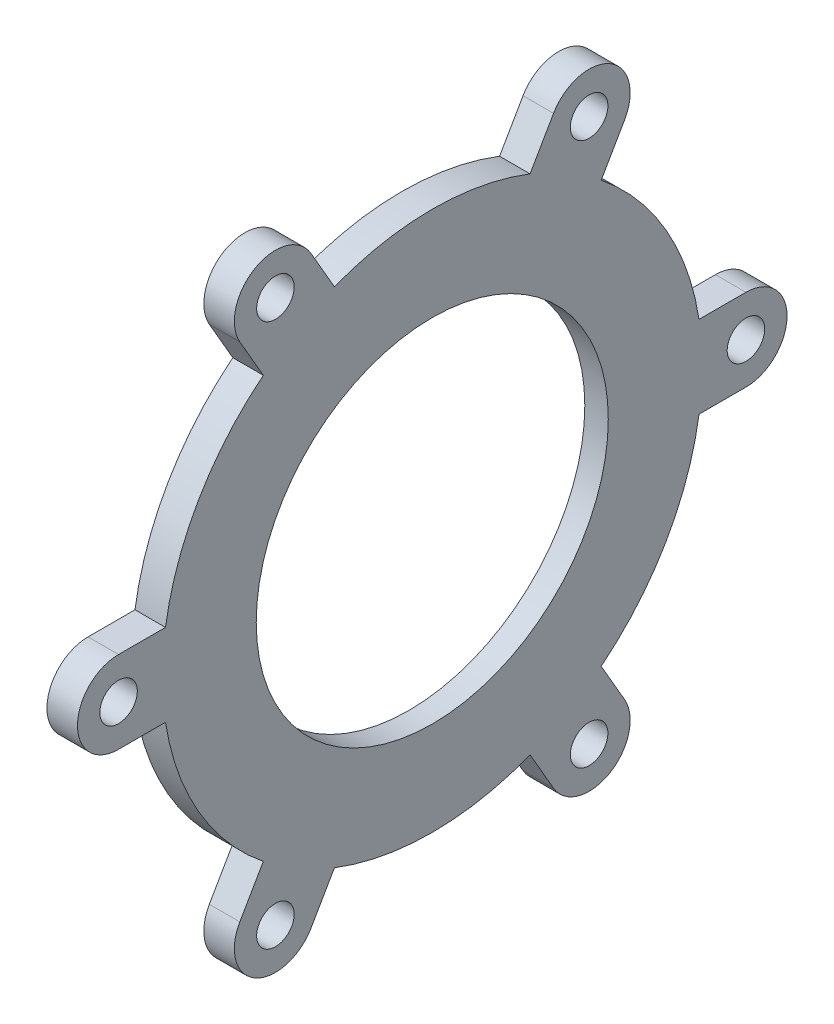
from build123d import *

# Parameters (mm, degrees)
SKETCH2_R           = 8
SKETCH2_R_2         = 75
BOSS_EXTRUDE1_DEPTH = 10
BOSS_EXTRUDE2_START = -3
SKETCH2_5_R         = 8
SKETCH2_5_R_2       = 95
BOSS_EXTRUDE2_DEPTH = 3
FILLET1_R           = 2.5


with BuildPart() as part:
    # Sketch2 → Boss-Extrude1 (new body)
    with BuildSketch(Plane(origin=(0, 0, 0), x_dir=(0, 0, -1), z_dir=(1, 0, 0))):
        with BuildLine():
            Line((133.660679217, 17.5), (113.660679217, 17.5))
            ThreePointArc((113.660679217, 17.5), (99.592921435, 57.5), (71.985784175, 89.683035613))
            Line((71.985784175, 89.683035613), (81.985784175, 107.003543689))
            ThreePointArc((81.985784175, 107.003543689), (75.580339608, 130.908988255), (51.674895042, 124.503543689))
            Line((51.674895042, 124.503543689), (41.674895042, 107.183035613))
            ThreePointArc((41.674895042, 107.183035613), (0, 115), (-41.674895042, 107.183035613))
            Line((-41.674895042, 107.183035613), (-51.674895042, 124.503543689))
            ThreePointArc((-51.674895042, 124.503543689), (-75.580339608, 130.908988255), (-81.985784175, 107.003543689))
            Line((-81.985784175, 107.003543689), (-71.985784175, 89.683035613))
            ThreePointArc((-71.985784175, 89.683035613), (-99.592921435, 57.5), (-113.660679217, 17.5))
            Line((-113.660679217, 17.5), (-133.660679217, 17.5))
            ThreePointArc((-133.660679217, 17.5), (-151.160679217, 0), (-133.660679217, -17.5))
            Line((-133.660679217, -17.5), (-113.660679217, -17.5))
            ThreePointArc((-113.660679217, -17.5), (-99.592921435, -57.5), (-71.985784175, -89.683035613))
            Line((-71.985784175, -89.683035613), (-81.985784175, -107.003543689))
            ThreePointArc((-81.985784175, -107.003543689), (-75.580339608, -130.908988255), (-51.674895042, -124.503543689))
            Line((-51.674895042, -124.503543689), (-41.674895042, -107.183035613))
            ThreePointArc((-41.674895042, -107.183035613), (0, -115), (41.674895042, -107.183035613))
            Line((41.674895042, -107.183035613), (51.674895042, -124.503543689))
            ThreePointArc((51.674895042, -124.503543689), (75.580339608, -130.908988255), (81.985784175, -107.003543689))
            Line((81.985784175, -107.003543689), (71.985784175, -89.683035613))
            ThreePointArc((71.985784175, -89.683035613), (99.592921435, -57.5), (113.660679217, -17.5))
            Line((113.660679217, -17.5), (133.660679217, -17.5))
            ThreePointArc((133.660679217, -17.5), (151.160679217, 0), (133.660679217, 17.5))
        make_face()
        with Locations((133.660679217, 0)):
            Circle(SKETCH2_R, mode=Mode.SUBTRACT)
        Circle(SKETCH2_R_2, mode=Mode.SUBTRACT)
        with Locations((66.830339608, -115.753543689)):
            Circle(SKETCH2_R, mode=Mode.SUBTRACT)
        with Locations((-66.830339608, -115.753543689)):
            Circle(SKETCH2_R, mode=Mode.SUBTRACT)
        with Locations((-133.660679217, 0)):
            Circle(SKETCH2_R, mode=Mode.SUBTRACT)
        with Locations((-66.830339608, 115.753543689)):
            Circle(SKETCH2_R, mode=Mode.SUBTRACT)
        with Locations((66.830339608, 115.753543689)):
            Circle(SKETCH2_R, mode=Mode.SUBTRACT)
    extrude(amount=BOSS_EXTRUDE1_DEPTH)

    # Sketch2<5> → Boss-Extrude2 (add)
    with BuildSketch(Plane(origin=(0, 0, 0), x_dir=(0, 0, -1), z_dir=(1, 0, 0)).offset(BOSS_EXTRUDE2_START)):
        with BuildLine():
            Line((133.660679217, 17.5), (113.660679217, 17.5))
            ThreePointArc((113.660679217, 17.5), (99.592921435, 57.5), (71.985784175, 89.683035613))
            Line((71.985784175, 89.683035613), (81.985784175, 107.003543689))
            ThreePointArc((81.985784175, 107.003543689), (75.580339608, 130.908988255), (51.674895042, 124.503543689))
            Line((51.674895042, 124.503543689), (41.674895042, 107.183035613))
            ThreePointArc((41.674895042, 107.183035613), (0, 115), (-41.674895042, 107.183035613))
            Line((-41.674895042, 107.183035613), (-51.674895042, 124.503543689))
            ThreePointArc((-51.674895042, 124.503543689), (-75.580339608, 130.908988255), (-81.985784175, 107.003543689))
            Line((-81.985784175, 107.003543689), (-71.985784175, 89.683035613))
            ThreePointArc((-71.985784175, 89.683035613), (-99.592921435, 57.5), (-113.660679217, 17.5))
            Line((-113.660679217, 17.5), (-133.660679217, 17.5))
            ThreePointArc((-133.660679217, 17.5), (-151.160679217, 0), (-133.660679217, -17.5))
            Line((-133.660679217, -17.5), (-113.660679217, -17.5))
            ThreePointArc((-113.660679217, -17.5), (-99.592921435, -57.5), (-71.985784175, -89.683035613))
            Line((-71.985784175, -89.683035613), (-81.985784175, -107.003543689))
            ThreePointArc((-81.985784175, -107.003543689), (-75.580339608, -130.908988255), (-51.674895042, -124.503543689))
            Line((-51.674895042, -124.503543689), (-41.674895042, -107.183035613))
            ThreePointArc((-41.674895042, -107.183035613), (0, -115), (41.674895042, -107.183035613))
            Line((41.674895042, -107.183035613), (51.674895042, -124.503543689))
            ThreePointArc((51.674895042, -124.503543689), (75.580339608, -130.908988255), (81.985784175, -107.003543689))
            Line((81.985784175, -107.003543689), (71.985784175, -89.683035613))
            ThreePointArc((71.985784175, -89.683035613), (99.592921435, -57.5), (113.660679217, -17.5))
            Line((113.660679217, -17.5), (133.660679217, -17.5))
            ThreePointArc((133.660679217, -17.5), (151.160679217, 0), (133.660679217, 17.5))
        make_face()
        with Locations((133.660679217, 0)):
            Circle(SKETCH2_5_R, mode=Mode.SUBTRACT)
        Circle(SKETCH2_5_R_2, mode=Mode.SUBTRACT)
        with Locations((66.830339608, -115.753543689)):
            Circle(SKETCH2_5_R, mode=Mode.SUBTRACT)
        with Locations((-66.830339608, -115.753543689)):
            Circle(SKETCH2_5_R, mode=Mode.SUBTRACT)
        with Locations((-133.660679217, 0)):
            Circle(SKETCH2_5_R, mode=Mode.SUBTRACT)
        with Locations((-66.830339608, 115.753543689)):
            Circle(SKETCH2_5_R, mode=Mode.SUBTRACT)
        with Locations((66.830339608, 115.753543689)):
            Circle(SKETCH2_5_R, mode=Mode.SUBTRACT)
    extrude(amount=BOSS_EXTRUDE2_DEPTH)

    # Fillet1
    fillet1_edges = [part.edges().sort_by_distance(p)[0] for p in [
        (0, 0, 95),
    ]]
    fillet(fillet1_edges, radius=FILLET1_R)


solid = part.part
